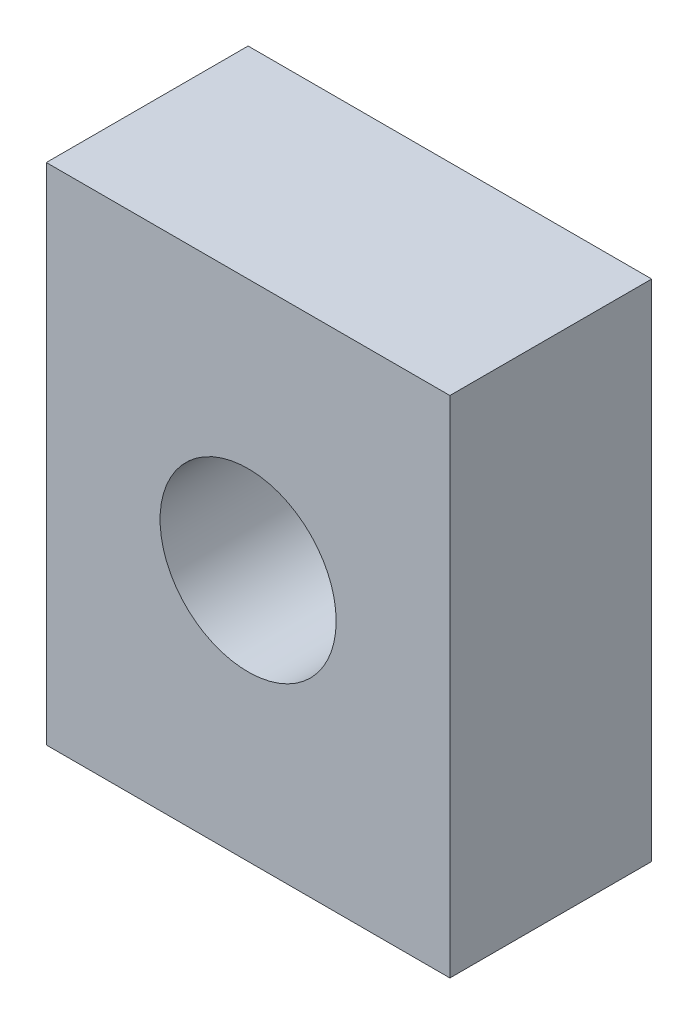
from build123d import *

# Parameters (mm, degrees)
BLOCKBASE_W        = 101.6
BLOCKBASE_H        = 127
BLOCK_DEPTH        = 50.8
SKETCH1_R          = 22.165931145
CUT_EXTRUDE1_DEPTH = 96.882897328


with BuildPart() as part:
    # BlockBase → Block (new body)
    with BuildSketch(Plane.XY):
        Rectangle(BLOCKBASE_W, BLOCKBASE_H)
    extrude(amount=BLOCK_DEPTH)

    # Sketch1 → Cut-Extrude1 (cut, through all)
    with BuildSketch(Plane.XY.offset(50.8)):
        Circle(SKETCH1_R)
    extrude(amount=-CUT_EXTRUDE1_DEPTH, mode=Mode.SUBTRACT)


solid = part.part
